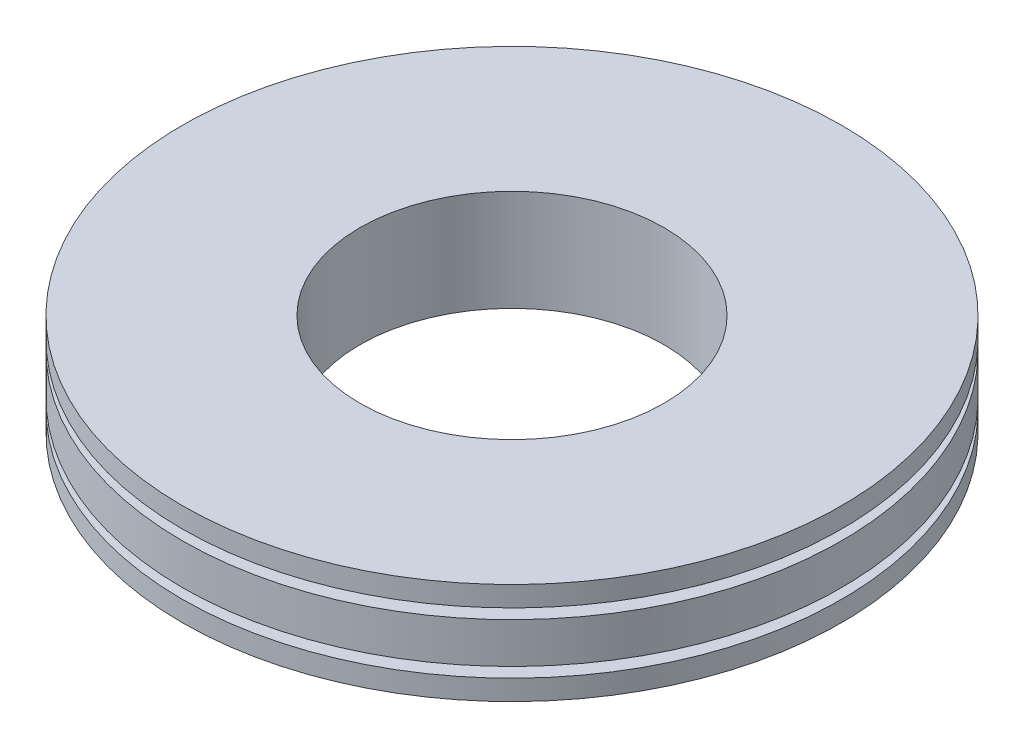
from build123d import *

# Parameters (mm, degrees)
SKETCH_1_R          = 13
EXTRUDE_1_DEPTH     = 4
SKETCH_2_R          = 6
CUT_EXTRUDE_1_DEPTH = 4
CUT_EXTRUDE_START   = -0.8
SKETCH_3_R          = 13
SKETCH_3_R_2        = 12
CUT_EXTRUDE_2_DEPTH = 0.4
CUT_EXTRUDE_START_2 = -2.8
SKETCH_3_3_R        = 13
SKETCH_3_3_R_2      = 12
CUT_EXTRUDE_3_DEPTH = 0.4


with BuildPart() as part:
    # 草图1 → 凸台-拉伸1 (new body)
    with BuildSketch(Plane(origin=(0, 0, 0), x_dir=(1, 0, 0), z_dir=(0, 1, 0))):
        with Locations(Location((0, 0, 0), (0, 0, 270))):
            Circle(SKETCH_1_R)
    extrude(amount=EXTRUDE_1_DEPTH)

    # 草图2 → 切除-拉伸1 (cut)
    with BuildSketch(Plane.XZ):
        with Locations(Location((0, 0, 0), (0, 0, 270))):
            Circle(SKETCH_2_R)
    extrude(amount=-CUT_EXTRUDE_1_DEPTH, mode=Mode.SUBTRACT)

    # 草图3 → 切除-拉伸2 (cut)
    with BuildSketch(Plane.XZ.offset(CUT_EXTRUDE_START)):
        with Locations(Location((0, 0, 0), (0, 0, 270))):
            Circle(SKETCH_3_R)
        with Locations(Location((0, 0, 0), (0, 0, 270))):
            Circle(SKETCH_3_R_2, mode=Mode.SUBTRACT)
    extrude(amount=-CUT_EXTRUDE_2_DEPTH, mode=Mode.SUBTRACT)

    # 草图3<3> → 切除-拉伸3 (cut)
    with BuildSketch(Plane.XZ.offset(CUT_EXTRUDE_START_2)):
        with Locations(Location((0, 0, 0), (0, 0, 270))):
            Circle(SKETCH_3_3_R)
        with Locations(Location((0, 0, 0), (0, 0, 270))):
            Circle(SKETCH_3_3_R_2, mode=Mode.SUBTRACT)
    extrude(amount=-CUT_EXTRUDE_3_DEPTH, mode=Mode.SUBTRACT)


solid = part.part
